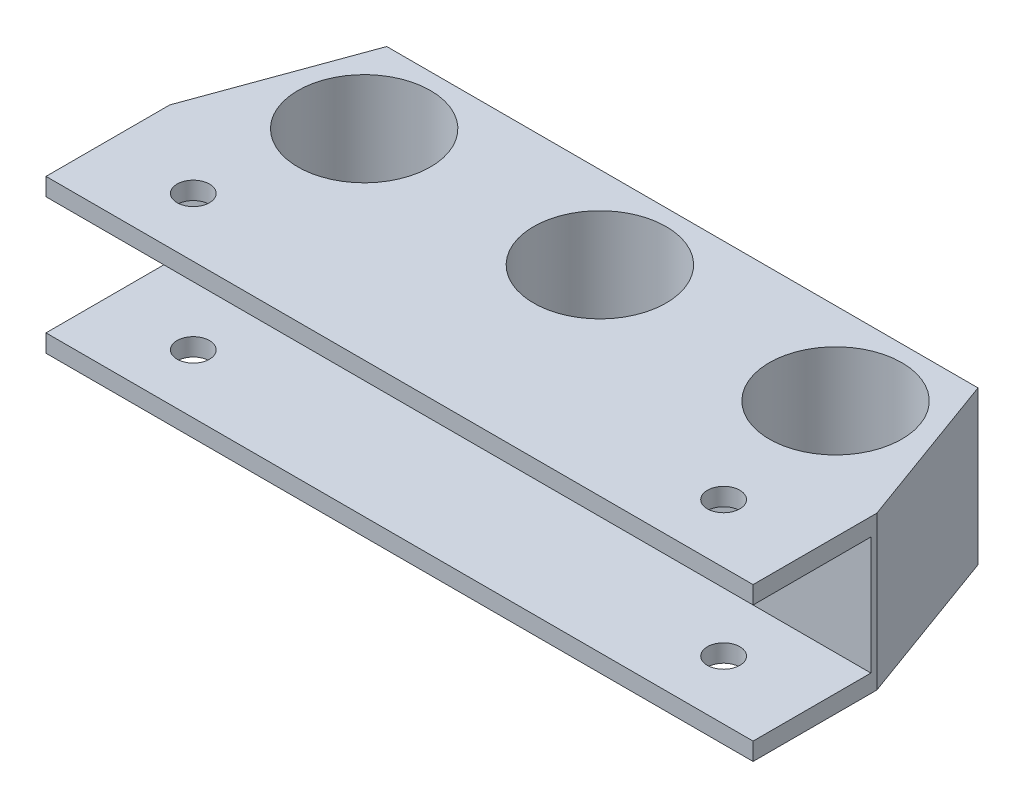
from build123d import *

# Parameters (mm, degrees)
SKETCH_1_R              = 11.25
EXTRUDE_1_DEPTH         = 13
SKETCH_2_W              = 20
SKETCH_2_H              = 20
CUT_EXTRUDE_1_DEPTH     = 127.393235578
CUT_EXTRUDE1_DEPTH      = 75.399260749
CUT_EXTRUDE1_DEPTH_BACK = 75.399260749
SKETCH1_R               = 2.75


with BuildPart() as part:
    # Эскиз1 → Бобышка-Вытянуть1 (new, symmetric)
    with BuildSketch(Plane(origin=(0, 0, 0), x_dir=(1, 0, 0), z_dir=(0, 1, 0))):
        Polygon((-60, -10.5), (60, -10.5), (60, 10.5), (50.172803675, 37.5), (0, 37.5), (-50.172803675, 37.5), (-60, 10.5), align=None)
        with Locations(Location((0, 23.5, 0), (0, 0, 90))):
            Circle(SKETCH_1_R, mode=Mode.SUBTRACT)
        with Locations(Location((-40, 23.5, 0), (0, 0, 90))):
            Circle(SKETCH_1_R, mode=Mode.SUBTRACT)
        with Locations(Location((40, 23.5, 0), (0, 0, 90))):
            Circle(SKETCH_1_R, mode=Mode.SUBTRACT)
    extrude(amount=EXTRUDE_1_DEPTH, both=True)

    # Эскиз2 → Вырез-Вытянуть1 (cut, through all)
    with BuildSketch(Plane.ZY.offset(60)):
        with Locations((0.5, 0)):
            Rectangle(SKETCH_2_W, SKETCH_2_H)
    extrude(amount=-CUT_EXTRUDE_1_DEPTH, mode=Mode.SUBTRACT)

    # Sketch1 → Cut-Extrude1 (cut, two sides: drawn at the far end of the back side and taken through both)
    with BuildSketch(Plane.XZ.offset(-10).offset(-CUT_EXTRUDE1_DEPTH_BACK)):
        with Locations(Location((45, 0.5, 0), (0, 0, 270))):
            Circle(SKETCH1_R)
        with Locations(Location((-45, 0.5, 0), (0, 0, 270))):
            Circle(SKETCH1_R)
    extrude(amount=CUT_EXTRUDE1_DEPTH + CUT_EXTRUDE1_DEPTH_BACK, mode=Mode.SUBTRACT)


solid = part.part
